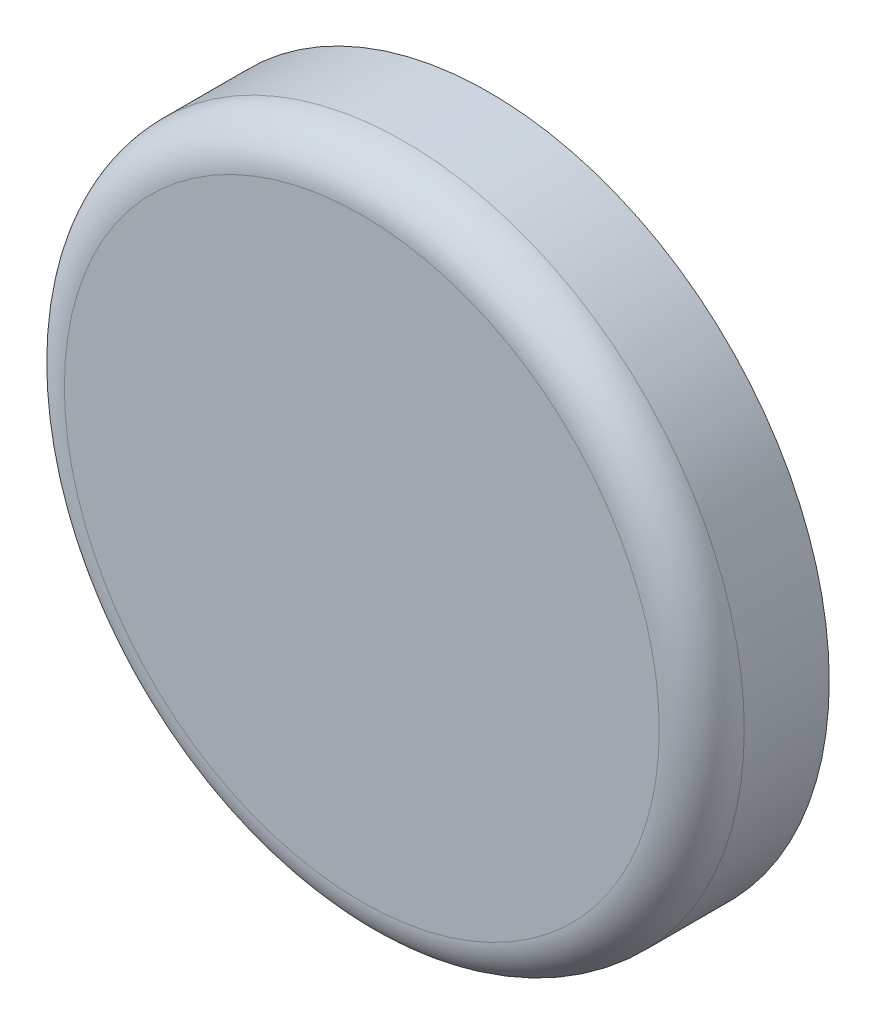
from build123d import *

# Parameters (mm, degrees)
SKETCH1_R           = 40
BOSS_EXTRUDE1_DEPTH = 15
FILLET1_R           = 5
SCALE1_SCALE        = 2


with BuildPart() as part:
    # Sketch1 → Boss-Extrude1 (new body)
    with BuildSketch(Plane.XY):
        Circle(SKETCH1_R)
    extrude(amount=BOSS_EXTRUDE1_DEPTH)

    # Fillet1
    fillet1_edges = [part.edges().sort_by_distance(p)[0] for p in [
        (-40, 0, 15),
    ]]
    fillet(fillet1_edges, radius=FILLET1_R)


with BuildPart() as part_1:
    # Scale1: scaled about (0, 0, 7.387306203)
    add(part.part.scale(SCALE1_SCALE).moved(Location((0, 0, -7.387306203))))


solid = part_1.part
